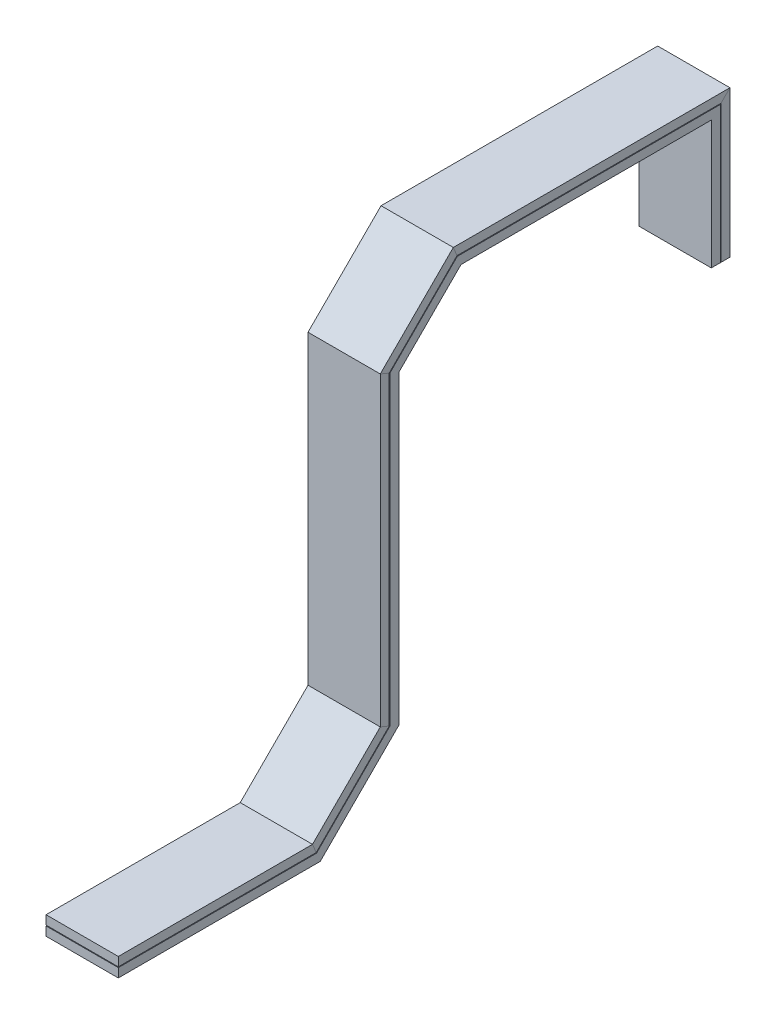
from build123d import *

# Parameters (mm, degrees)
CROQUIS1_W              = 50.8
CROQUIS1_H              = 6.31
SALIENTE_EXTRUIR1_DEPTH = 50.8


with BuildPart() as part:
    # Barrer1: sweep along a curve in space
    with BuildLine() as barrer1_path:
        Line((0, 0, 0), (0, 100, 0))
        Line((0, 100, 0), (0, 100, 190))
        Line((0, 100, 190), (0, 50.502525317, 239.497474683))
        Line((0, 50.502525317, 239.497474683), (0, -164.382525317, 239.497474683))
        Line((0, -164.382525317, 239.497474683), (0, -213.88, 288.994949366))
        Line((0, -213.88, 288.994949366), (0, -213.88, 426.794949366))
    # Croquis1 → Barrer1 (sweep)
    with BuildSketch(Plane(origin=(0, 0, 0), x_dir=(1, 0, 0), z_dir=(0, 1, 0))):
        Rectangle(CROQUIS1_W, CROQUIS1_H)
    sweep(path=barrer1_path.line, transition=Transition.RIGHT)


with BuildPart() as body_2:
    # Croquis2 → Saliente-Extruir1 (new body)
    with BuildSketch(Plane.ZY.offset(25.4)):
        Polygon((3.655, 0), (3.655, 96.345), (188.48604943, 96.345), (235.842474683, 48.988574746), (235.842474683, -165.896475887), (287.480998796, -217.535), (426.794949366, -217.535), (426.794949366, -223.845), (284.867311217, -223.845), (229.532474683, -168.510163466), (229.532474683, 46.374887168), (185.872361851, 90.035), (9.965, 90.035), (9.965, 0), align=None)
    extrude(amount=-SALIENTE_EXTRUIR1_DEPTH)


solid = Compound([part.part, body_2.part])
